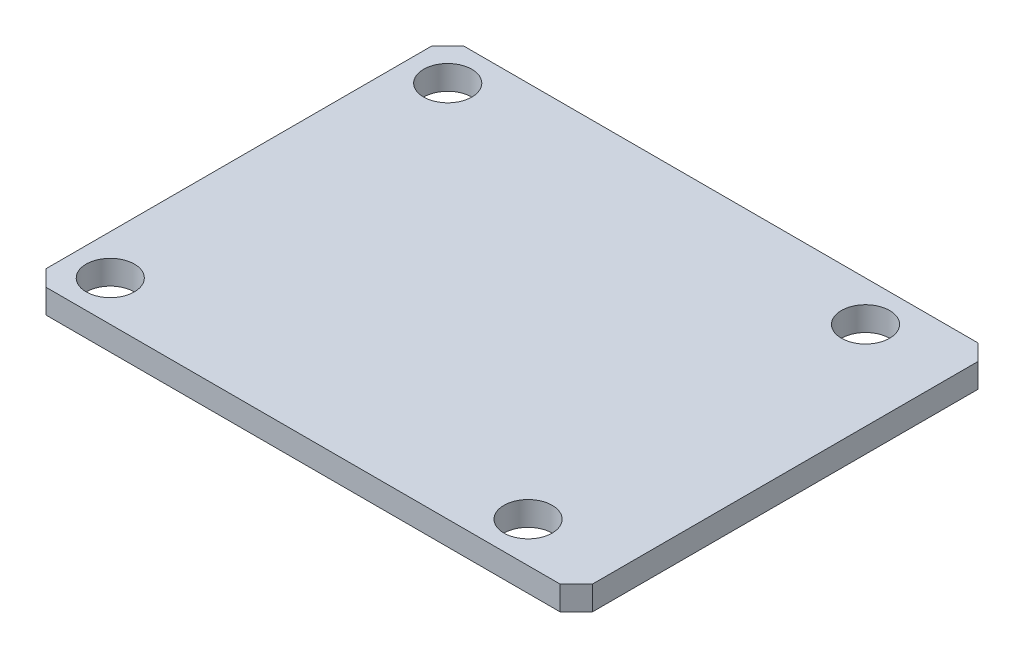
from build123d import *

# Parameters (mm, degrees)
SKETCH1_W           = 34
SKETCH1_H           = 26
BOSS_EXTRUDE1_DEPTH = 1.5
SKETCH2_R           = 1.5
CUT_EXTRUDE1_DEPTH  = 1.5
CHAMFER1_SIZE       = 1


with BuildPart() as part:
    # Sketch1 → Boss-Extrude1 (new body)
    with BuildSketch(Plane(origin=(0, 0, 0), x_dir=(1, 0, 0), z_dir=(0, 1, 0))):
        Rectangle(SKETCH1_W, SKETCH1_H)
    extrude(amount=BOSS_EXTRUDE1_DEPTH)

    # Sketch2 → Cut-Extrude1 (cut)
    with BuildSketch(Plane(origin=(0, 1.5, 0), x_dir=(1, 0, 0), z_dir=(0, 1, 0))):
        with Locations(Location((-14.5, 10.5, 0), (0, 0, 270))):
            Circle(SKETCH2_R)
        with Locations(Location((11.5, 10.5, 0), (0, 0, 270))):
            Circle(SKETCH2_R)
        with Locations(Location((11.5, -10.5, 0), (0, 0, 270))):
            Circle(SKETCH2_R)
        with Locations(Location((-14.5, -10.5, 0), (0, 0, 270))):
            Circle(SKETCH2_R)
    extrude(amount=-CUT_EXTRUDE1_DEPTH, mode=Mode.SUBTRACT)

    # Chamfer1
    chamfer1_edges = [part.edges().sort_by_distance(p)[0] for p in [
        (17, 0.75, 13),
        (-17, 0.75, 13),
        (-17, 0.75, -13),
        (17, 0.75, -13),
    ]]
    chamfer(chamfer1_edges, length=CHAMFER1_SIZE)


solid = part.part
